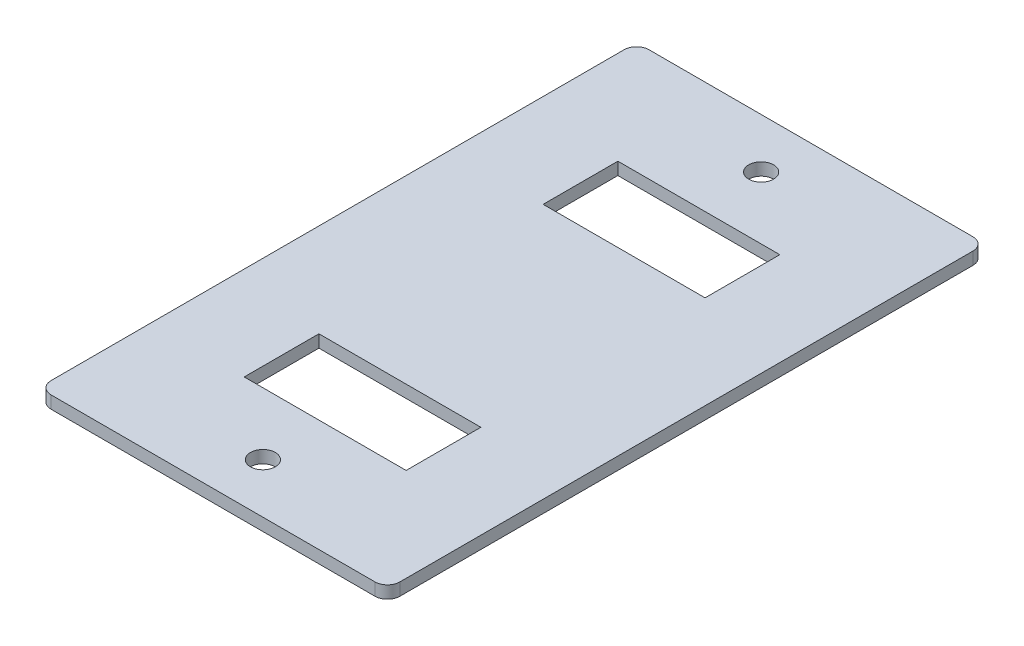
from build123d import *

# Parameters (mm, degrees)
CROQUIS1_W              = 70
CROQUIS1_H              = 120
SALIENTE_EXTRUIR1_DEPTH = 2.5
REDONDEO1_R             = 2.5
CROQUIS2_W              = 32.5
CROQUIS2_H              = 15
CORTAR_EXTRUIR1_DEPTH   = 70.507193872
CROQUIS3_R              = 2.5
CORTAR_EXTRUIR2_DEPTH   = 70.507193872


with BuildPart() as part:
    # Croquis1 → Saliente-Extruir1 (new body)
    with BuildSketch(Plane(origin=(0, 0, 0), x_dir=(1, 0, 0), z_dir=(0, 1, 0))):
        Rectangle(CROQUIS1_W, CROQUIS1_H)
    extrude(amount=SALIENTE_EXTRUIR1_DEPTH)

    # Redondeo1
    redondeo1_edges = [part.edges().sort_by_distance(p)[0] for p in [
        (35, 1.25, 60),
        (-35, 1.25, 60),
        (-35, 1.25, -60),
        (35, 1.25, -60),
    ]]
    fillet(redondeo1_edges, radius=REDONDEO1_R)

    # Croquis2 → Cortar-Extruir1 (cut, through all)
    with BuildSketch(Plane(origin=(0, 2.5, 0), x_dir=(1, 0, 0), z_dir=(0, 1, 0))):
        with Locations((0, 30)):
            Rectangle(CROQUIS2_W, CROQUIS2_H)
        with Locations((0, -30)):
            Rectangle(CROQUIS2_W, CROQUIS2_H)
    extrude(amount=-CORTAR_EXTRUIR1_DEPTH, mode=Mode.SUBTRACT)

    # Croquis3 → Cortar-Extruir2 (cut, through all)
    with BuildSketch(Plane(origin=(0, 2.5, 0), x_dir=(1, 0, 0), z_dir=(0, 1, 0))):
        with Locations(Location((0, 50, 0), (0, 0, 270))):
            Circle(CROQUIS3_R)
        with Locations(Location((0, -50, 0), (0, 0, 270))):
            Circle(CROQUIS3_R)
    extrude(amount=-CORTAR_EXTRUIR2_DEPTH, mode=Mode.SUBTRACT)


solid = part.part
